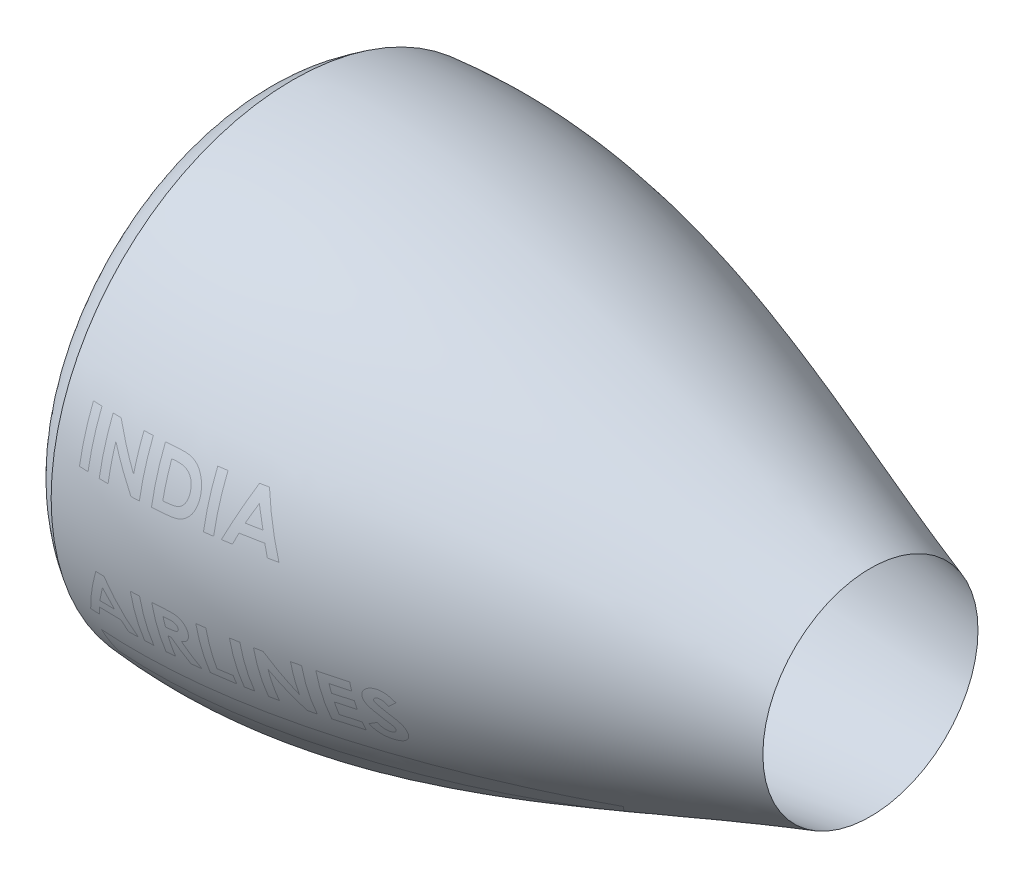
from build123d import *

# Parameters (mm, degrees)
THICKEN1_T1 = 5


with BuildPart() as body_1:
    # Surface-Revolve1: a surface, the sketch's curves turned about an axis
    with BuildLine(Plane.XY, mode=Mode.PRIVATE) as surface_revolve1_1_path:
        Line((0, 180), (25, 180))
        Line((25, 180), (37.891986063, 190))
        Line((37.891986063, 190), (62.891986063, 190))
        Line((62.891986063, 190), (580, 108))
        add(Edge.make_bspline(
            [(580, 108), (391.910460498, 169.43197282), (207.094253649, 262.834627607), (0, 242.596768495)],
            knots=[0, 0, 0, 0, 1, 1, 1, 1], degree=3))
        add(Edge.make_bspline(
            [(0, 242.596768495), (-61.2324544, 205.285747467), (0, 180)],
            knots=[0, 0, 0, 1, 1, 1], degree=2))
    surface_revolve1_1 = Shell.revolve(surface_revolve1_1_path.wire(), 360, Axis((0, 0, 0), (1, 0, 0)))
    add(Solid.thicken(surface_revolve1_1, THICKEN1_T1))


solid = body_1.part
